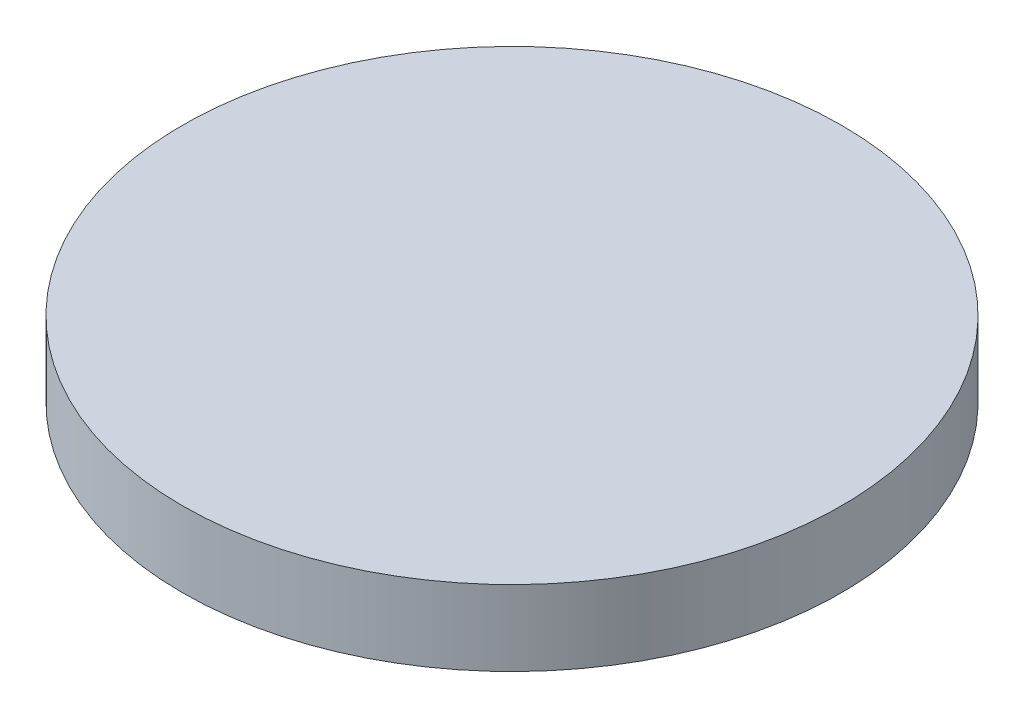
from build123d import *

# Parameters (mm, degrees)
SKETCH1_R           = 35
BOSS_EXTRUDE1_DEPTH = 8


with BuildPart() as part:
    # Sketch1 → Boss-Extrude1 (new body)
    with BuildSketch(Plane(origin=(0, 0, 0), x_dir=(1, 0, 0), z_dir=(0, 1, 0))):
        with Locations(Location((0, 0, 0), (0, 0, 270))):
            Circle(SKETCH1_R)
    extrude(amount=BOSS_EXTRUDE1_DEPTH)


solid = part.part
